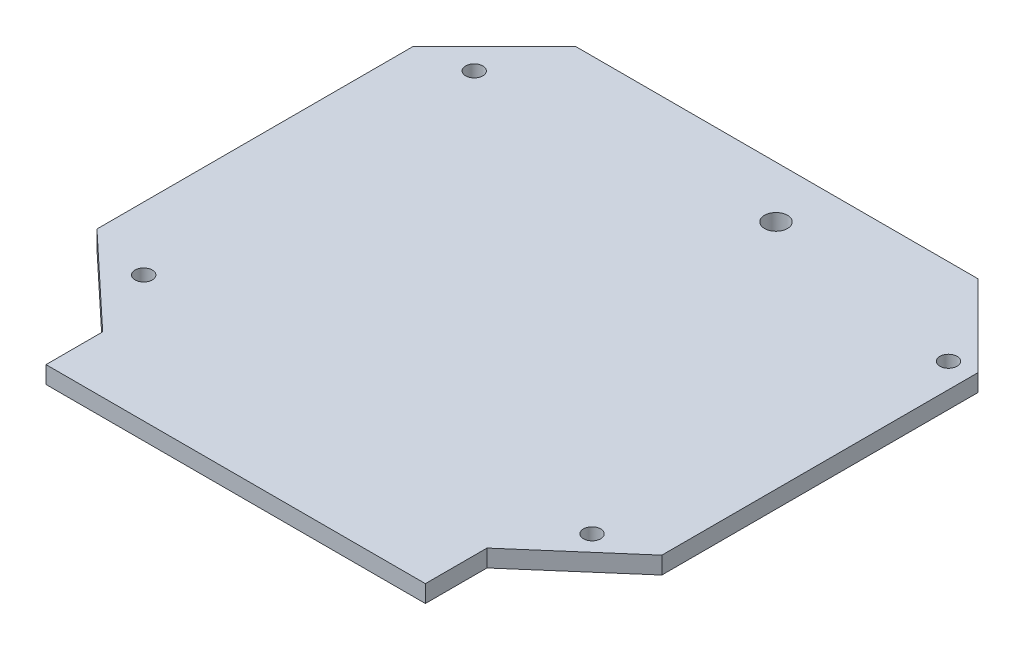
from build123d import *

# Parameters (mm, degrees)
SKETCH_1_R      = 1.5
SKETCH_1_R_2    = 2
EXTRUDE_1_DEPTH = 3


with BuildPart() as part:
    # 草图1 → 凸台-拉伸1 (new body)
    with BuildSketch(Plane(origin=(0, 0, 0), x_dir=(1, 0, 0), z_dir=(0, 1, 0))):
        Polygon((14.14, 0), (84.14, 0), (98.28, -14.14), (98.28, -69.14), (82, -83.28), (82, -94), (16, -94), (16, -84.14), (0, -69.14), (0, -14.14), align=None)
        with Locations(Location((9, -12.5, 0), (0, 0, 270))):
            Circle(SKETCH_1_R, mode=Mode.SUBTRACT)
        with Locations(Location((94, -15, 0), (0, 0, 270))):
            Circle(SKETCH_1_R, mode=Mode.SUBTRACT)
        with Locations(Location((11, -72, 0), (0, 0, 270))):
            Circle(SKETCH_1_R, mode=Mode.SUBTRACT)
        with Locations(Location((89, -72, 0), (0, 0, 270))):
            Circle(SKETCH_1_R, mode=Mode.SUBTRACT)
        with Locations(Location((58, -9, 0), (0, 0, 270))):
            Circle(SKETCH_1_R_2, mode=Mode.SUBTRACT)
    extrude(amount=EXTRUDE_1_DEPTH)


solid = part.part
